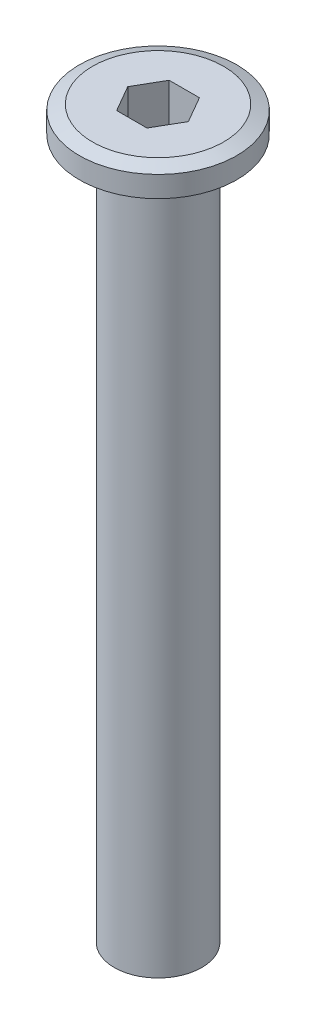
from build123d import *

# Parameters (mm, degrees)
SKETCH3_R           = 2.5
BOSS_EXTRUDE1_DEPTH = 40
CUT_EXTRUDE2_DEPTH  = 3


with BuildPart() as part:
    # Sketch1 → Revolve1 (revolve)
    with BuildSketch(Plane.XY, mode=Mode.PRIVATE) as revolve1_sk:
        Polygon((-2.5, 0), (0, 0), (0, 1.5), (-3.75, 1.5), (-4.5, 1.2), (-4.5, 0), align=None)
    revolve(revolve1_sk.sketch.rotate(Axis((0, 0, 0), (0, 1, 0)), 270), axis=Axis((0, 0, 0), (0, 1, 0)))

    # Sketch3 → Boss-Extrude1 (add)
    with BuildSketch(Plane.XZ):
        with Locations(Location((0, 0, 0), (0, 0, 90))):
            Circle(SKETCH3_R)
    extrude(amount=BOSS_EXTRUDE1_DEPTH)

    # Sketch2 → Cut-Extrude2 (cut)
    with BuildSketch(Plane(origin=(0, 1.5, 0), x_dir=(1, 0, 0), z_dir=(0, 1, 0))):
        Polygon((1.732050808, 0), (0.866025404, 1.5), (-0.866025404, 1.5), (-1.732050808, 0), (-0.866025404, -1.5), (0.866025404, -1.5), align=None)
    extrude(amount=-CUT_EXTRUDE2_DEPTH, mode=Mode.SUBTRACT)


solid = part.part
